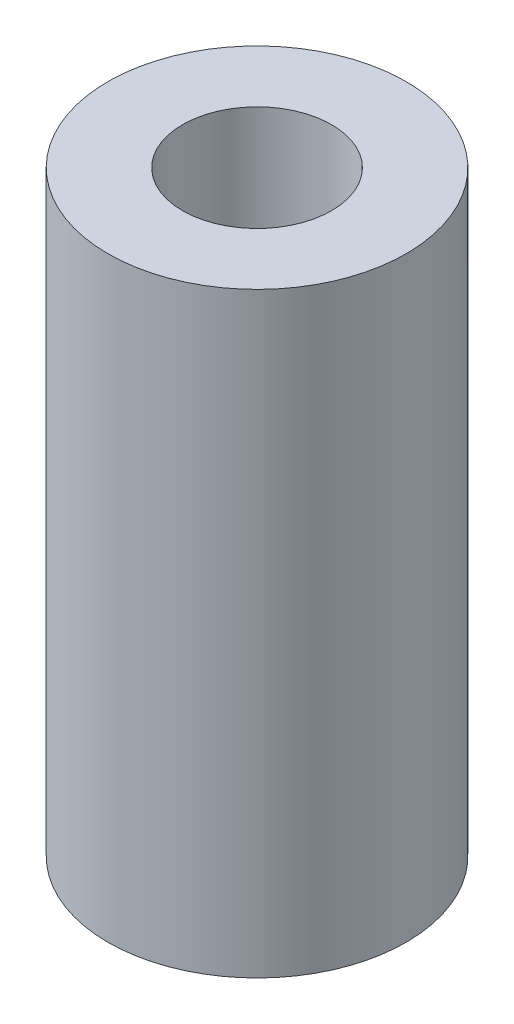
from build123d import *

# Parameters (mm, degrees)
ESQUISSE1_R             = 4
BOSS_EXTRU_1_DEPTH      = 16
ENL_V_MAT_EXTRU_1_REACH = 18.971
ESQUISSE2_R             = 2


with BuildPart() as part:
    # Esquisse1 → Boss.-Extru.1 (new body)
    with BuildSketch(Plane(origin=(0, 0, 0), x_dir=(1, 0, 0), z_dir=(0, 1, 0))):
        with Locations(Location((0, 0, 0), (0, 0, 270))):
            Circle(ESQUISSE1_R)
    extrude(amount=BOSS_EXTRU_1_DEPTH)

    # Esquisse2 → Enlèv. mat.-Extru.1 (cut, up to next)
    with BuildSketch(Plane(origin=(0, 16, 0), x_dir=(1, 0, 0), z_dir=(0, 1, 0)), mode=Mode.PRIVATE) as enl_v_mat_extru_1_sk1:
        with Locations(Location((0, 0, 0), (0, 0, 270))):
            Circle(ESQUISSE2_R)
    enl_v_mat_extru_1_tool1 = extrude(enl_v_mat_extru_1_sk1.sketch, amount=-ENL_V_MAT_EXTRU_1_REACH, mode=Mode.PRIVATE) & part.part
    add(enl_v_mat_extru_1_tool1.solids().sort_by_distance((0, 16, 0))[0], mode=Mode.SUBTRACT)


solid = part.part
